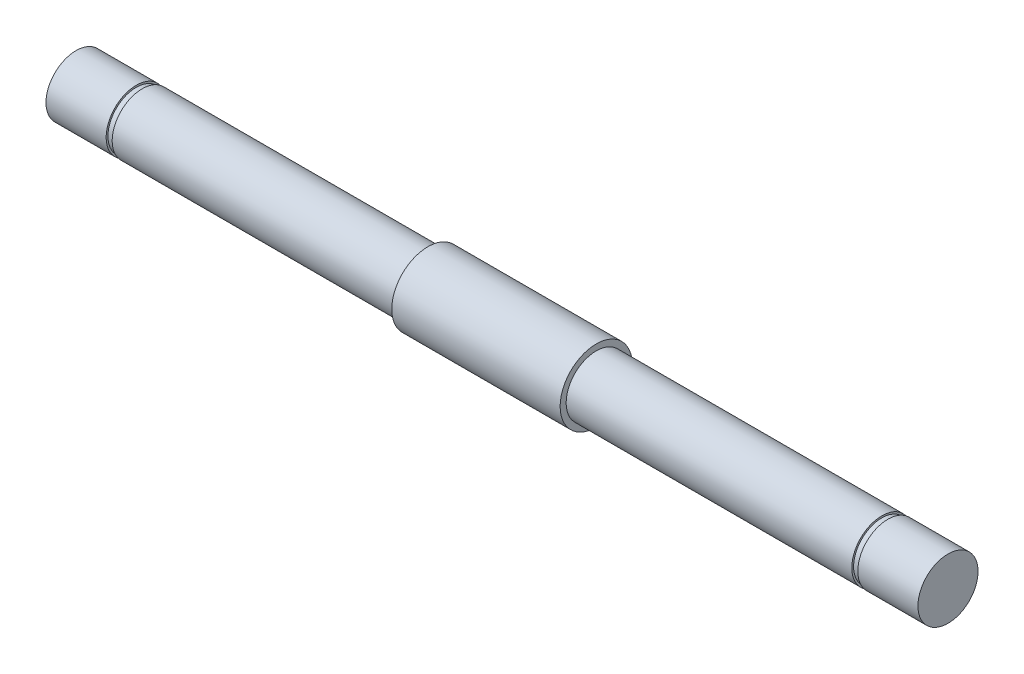
from build123d import *


with BuildPart() as part:
    # Esquisse1 → Révolution1 (revolve)
    with BuildSketch(Plane.XY, mode=Mode.PRIVATE) as r_volution1_sk:
        Polygon((14, 6), (-14, 6), (-14, 5), (-61.5, 5), (-61.5, 4.7), (-62.5, 4.7), (-62.5, 5), (-72.5, 5), (-72.5, 0), (72.5, 0), (72.5, 5), (62.5, 5), (62.5, 4.7), (61.5, 4.7), (61.5, 5), (14, 5), align=None)
    revolve(r_volution1_sk.sketch.rotate(Axis((0, 0, 0), (1, 0, 0)), 90), axis=Axis((0, 0, 0), (1, 0, 0)))


solid = part.part
